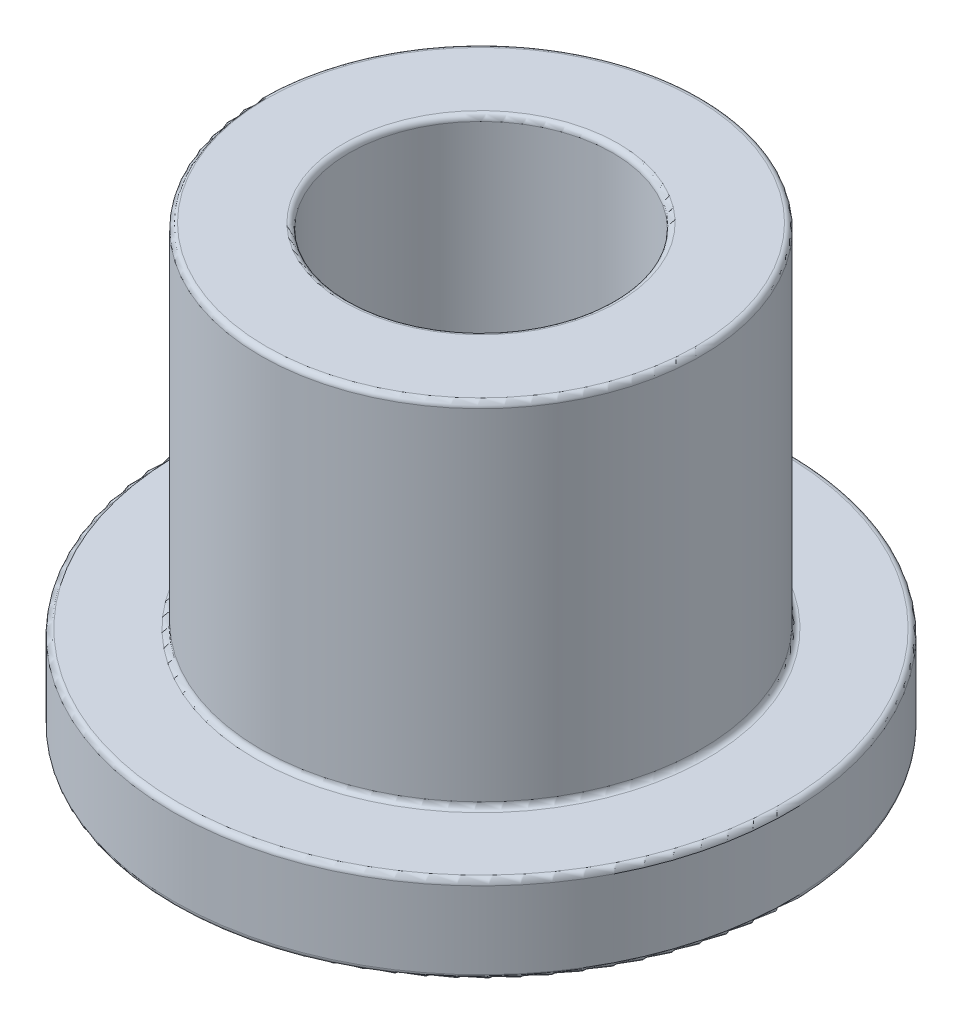
from build123d import *

# Parameters (mm, degrees)
SKETCH3_R           = 5.01
SKETCH3_R_2         = 3
BOSS_EXTRUDE1_DEPTH = 10
SKETCH4_R           = 7
SKETCH4_R_2         = 5.01
BOSS_EXTRUDE2_DEPTH = 2
FILLET1_R           = 0.125


with BuildPart() as part:
    # Sketch3 → Boss-Extrude1 (new body)
    with BuildSketch(Plane(origin=(0, 0, 0), x_dir=(1, 0, 0), z_dir=(0, 1, 0))):
        with Locations(Location((0, 0, 0), (0, 0, 270))):
            Circle(SKETCH3_R)
        with Locations(Location((0, 0, 0), (0, 0, 270))):
            Circle(SKETCH3_R_2, mode=Mode.SUBTRACT)
    extrude(amount=BOSS_EXTRUDE1_DEPTH)

    # Sketch4 → Boss-Extrude2 (add)
    with BuildSketch(Plane(origin=(0, 0, 0), x_dir=(1, 0, 0), z_dir=(0, 1, 0))):
        with Locations(Location((0, 0, 0), (0, 0, 270))):
            Circle(SKETCH4_R)
        with Locations(Location((0, 0, 0), (0, 0, 270))):
            Circle(SKETCH4_R_2, mode=Mode.SUBTRACT)
    extrude(amount=BOSS_EXTRUDE2_DEPTH)

    # Fillet1
    fillet1_edges = [part.edges().sort_by_distance(p)[0] for p in [
        (0, 0, -7),
        (0, 2, -5.01),
        (0, 10, -5.01),
        (0, 0, -3),
        (0, 10, -3),
        (0, 2, -7),
    ]]
    fillet(fillet1_edges, radius=FILLET1_R)


solid = part.part
